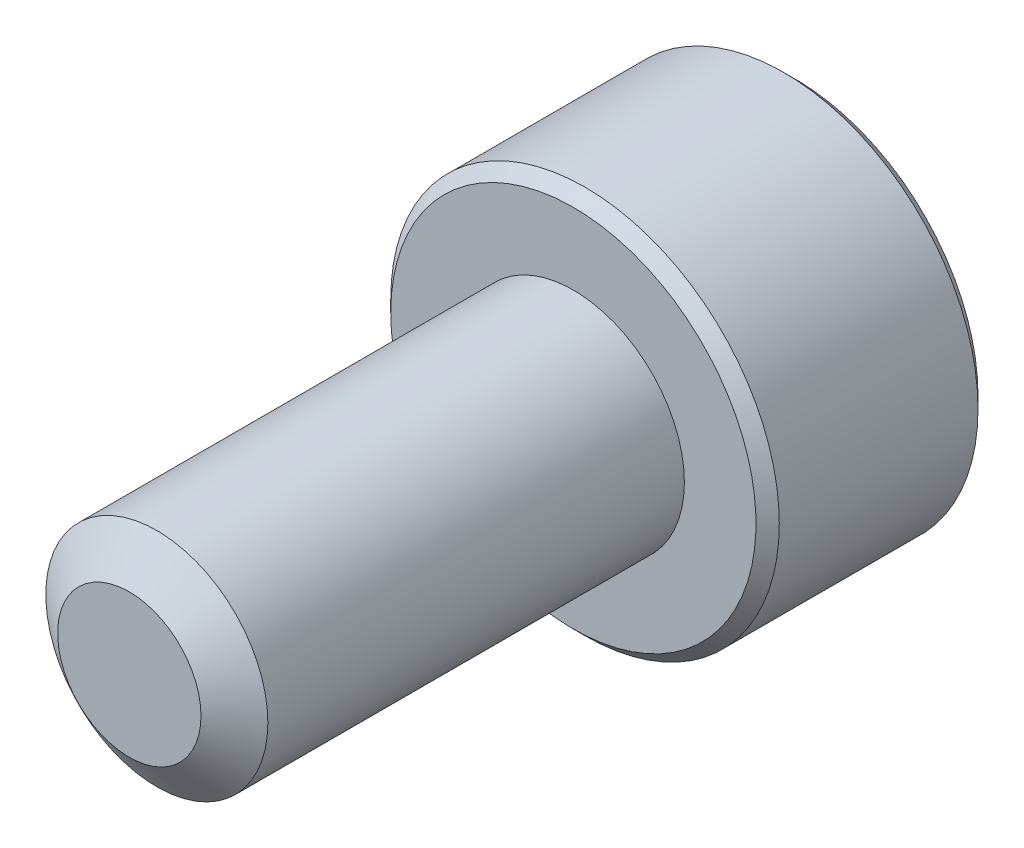
from build123d import *

# Parameters (mm, degrees)
SKETCH1_R          = 2
EXTRUDE1_DEPTH     = 8
SKETCH6_R          = 3.5
EXTRUDE2_DEPTH     = 4
CUT_EXTRUDE1_DEPTH = 2.25
CHAMFER1_SIZE      = 0.21


with BuildPart() as part:
    # Sketch1 → Extrude1 (new body)
    with BuildSketch(Plane.XY):
        Circle(SKETCH1_R)
    extrude(amount=-EXTRUDE1_DEPTH)

    # Sketch4 → Cut-Revolve1 (revolve, cut)
    with BuildSketch(Plane(origin=(0, 0, 0), x_dir=(0, 0, -1), z_dir=(1, 0, 0))):
        Polygon((0.496211411, 2), (0, 1.291336663), (0, 2), align=None)
    revolve(axis=Axis((0, 0, 0), (0, 0, -1)), mode=Mode.SUBTRACT)

    # Sketch6 → Extrude2 (add)
    with BuildSketch(Plane(origin=(0, 0, -8), x_dir=(-1, 0, 0), z_dir=(0, 0, -1))):
        Circle(SKETCH6_R)
    extrude(amount=EXTRUDE2_DEPTH)

    # Sketch7 → Cut-Extrude1 (cut)
    with BuildSketch(Plane(origin=(0, 0, -12), x_dir=(-1, 0, 0), z_dir=(0, 0, -1))):
        Polygon((0, 1.732050808), (-1.5, 0.866025404), (-1.5, -0.866025404), (0, -1.732050808), (1.5, -0.866025404), (1.5, 0.866025404), align=None)
    extrude(amount=-CUT_EXTRUDE1_DEPTH, mode=Mode.SUBTRACT)

    # Cut-Extrude2 cone 1 section (through the dimple's axis) → Cut-Extrude2 (revolve, cut)
    with BuildSketch(Plane(origin=(0, 0, -12), x_dir=(0, 1, 0), z_dir=(1, 0, 0))):
        Polygon((0, 0), (1.732050808, 0), (0, 1.732050808), align=None)
    revolve(axis=Axis((0, 0, -12), (0, 0, 1)), mode=Mode.SUBTRACT)

    # Chamfer1
    chamfer1_edges = [part.edges().sort_by_distance(p)[0] for p in [
        (3.5, 0, -12),
        (3.5, 0, -8),
    ]]
    chamfer(chamfer1_edges, length=CHAMFER1_SIZE)

    # Sketch10 → Revolve1 (revolve)
    with BuildSketch(Plane(origin=(0, 0, 0), x_dir=(0, 0, -1), z_dir=(1, 0, 0))):
        Polygon((8, 2), (8, 0), (6.996572875, 0), (7.825, 2), align=None)
    revolve(axis=Axis((0, 0, -8), (0, 0, 1)))


solid = part.part
